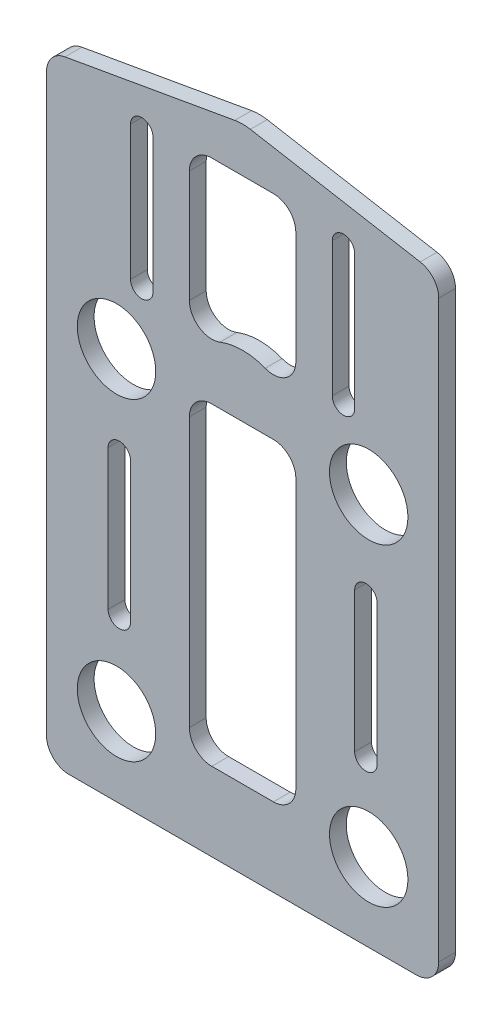
from build123d import *

# Parameters (mm, degrees)
CROQUIS1_R              = 3.5
SALIENTE_EXTRUIR1_DEPTH = 1.5


with BuildPart() as part:
    # Croquis1 → Saliente-Extruir1 (new body)
    with BuildSketch(Plane(origin=(0, 0, 0), x_dir=(-1, 0, 0), z_dir=(0, 0, -1))):
        with BuildLine():
            Line((15.847296355, 27.779408386), (0.694592711, 30.451238869))
            ThreePointArc((0.694592711, 30.451238869), (0, 30.512007857), (-0.694592711, 30.451238869))
            Line((-0.694592711, 30.451238869), (-15.847296355, 27.779408386))
            ThreePointArc((-15.847296355, 27.779408386), (-17.032088886, 27.0953681), (-17.5, 25.80979288))
            Line((-17.5, 25.80979288), (-17.5, -25.487992143))
            ThreePointArc((-17.5, -25.487992143), (-16.914213562, -26.902205705), (-15.5, -27.487992143))
            Line((-15.5, -27.487992143), (15.5, -27.487992143))
            ThreePointArc((15.5, -27.487992143), (16.914213562, -26.902205705), (17.5, -25.487992143))
            Line((17.5, -25.487992143), (17.5, 25.80979288))
            ThreePointArc((17.5, 25.80979288), (17.032088886, 27.0953681), (15.847296355, 27.779408386))
        make_face()
        with Locations(Location((11.25, 7.512007857, 0), (0, 0, 180))):
            Circle(CROQUIS1_R, mode=Mode.SUBTRACT)
        with Locations(Location((11.25, -20.487992143, 0), (0, 0, 180))):
            Circle(CROQUIS1_R, mode=Mode.SUBTRACT)
        with Locations(Location((-11.25, -20.487992143, 0), (0, 0, 180))):
            Circle(CROQUIS1_R, mode=Mode.SUBTRACT)
        with Locations(Location((-11.25, 7.512007857, 0), (0, 0, 180))):
            Circle(CROQUIS1_R, mode=Mode.SUBTRACT)
        with BuildLine():
            Line((-4.75, 14.512007857), (-4.75, 24.512007857))
            ThreePointArc((-4.75, 24.512007857), (-4.164213562, 25.92622142), (-2.75, 26.512007857))
            Line((-2.75, 26.512007857), (2.75, 26.512007857))
            ThreePointArc((2.75, 26.512007857), (4.164213562, 25.92622142), (4.75, 24.512007857))
            Line((4.75, 24.512007857), (4.75, 14.512007857))
            ThreePointArc((4.75, 14.512007857), (3.875930191, 12.859046513), (2.017718795, 12.650888776))
            ThreePointArc((2.017718795, 12.650888776), (0, 13.033559582), (-2.017718795, 12.650888776))
            ThreePointArc((-2.017718795, 12.650888776), (-3.875930191, 12.859046513), (-4.75, 14.512007857))
        make_face(mode=Mode.SUBTRACT)
        with BuildLine():
            Line((4.75, 5.512007857), (4.75, -18.487992143))
            ThreePointArc((4.75, -18.487992143), (4.164213562, -19.902205705), (2.75, -20.487992143))
            Line((2.75, -20.487992143), (-2.75, -20.487992143))
            ThreePointArc((-2.75, -20.487992143), (-4.164213562, -19.902205705), (-4.75, -18.487992143))
            Line((-4.75, -18.487992143), (-4.75, 5.512007857))
            ThreePointArc((-4.75, 5.512007857), (-4.164213562, 6.92622142), (-2.75, 7.512007857))
            Line((-2.75, 7.512007857), (2.75, 7.512007857))
            ThreePointArc((2.75, 7.512007857), (4.164213562, 6.92622142), (4.75, 5.512007857))
        make_face(mode=Mode.SUBTRACT)
        with BuildLine():
            Line((12, -0.487992143), (12, -12.987992143))
            ThreePointArc((12, -12.987992143), (11, -13.987992143), (10, -12.987992143))
            Line((10, -12.987992143), (10, -0.487992143))
            ThreePointArc((10, -0.487992143), (11, 0.512007857), (12, -0.487992143))
        make_face(mode=Mode.SUBTRACT)
        with BuildLine():
            Line((10, 25.512007857), (10, 13.512007857))
            ThreePointArc((10, 13.512007857), (9, 12.512007857), (8, 13.512007857))
            Line((8, 13.512007857), (8, 25.512007857))
            ThreePointArc((8, 25.512007857), (9, 26.512007857), (10, 25.512007857))
        make_face(mode=Mode.SUBTRACT)
        with BuildLine():
            Line((-10, -0.487992143), (-10, -12.987992143))
            ThreePointArc((-10, -12.987992143), (-11, -13.987992143), (-12, -12.987992143))
            Line((-12, -12.987992143), (-12, -0.487992143))
            ThreePointArc((-12, -0.487992143), (-11, 0.512007857), (-10, -0.487992143))
        make_face(mode=Mode.SUBTRACT)
        with BuildLine():
            Line((-8, 25.512007857), (-8, 13.512007857))
            ThreePointArc((-8, 13.512007857), (-9, 12.512007857), (-10, 13.512007857))
            Line((-10, 13.512007857), (-10, 25.512007857))
            ThreePointArc((-10, 25.512007857), (-9, 26.512007857), (-8, 25.512007857))
        make_face(mode=Mode.SUBTRACT)
    extrude(amount=-SALIENTE_EXTRUIR1_DEPTH)


solid = part.part
